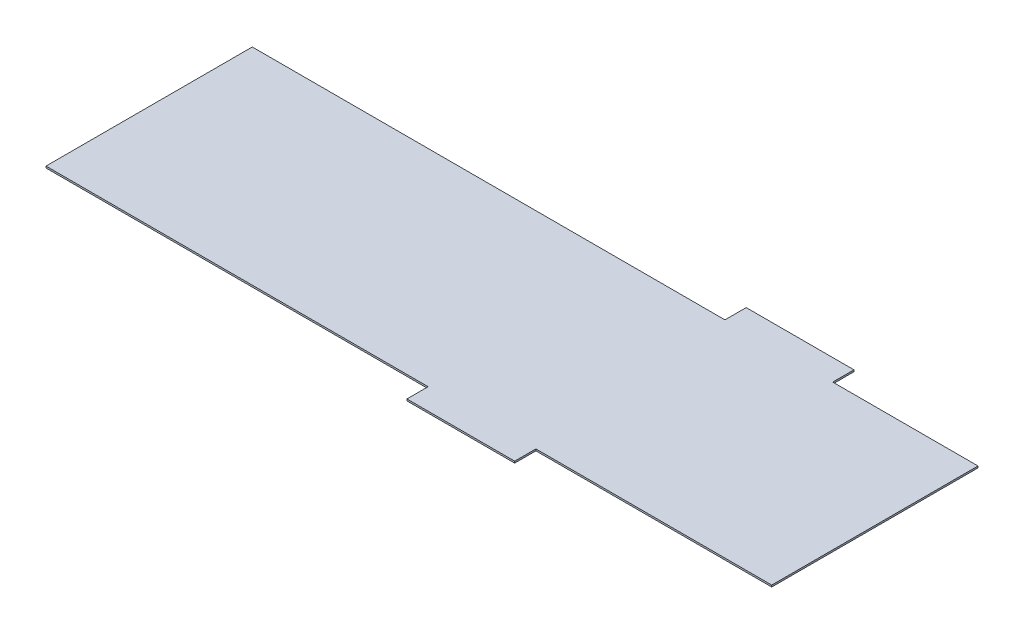
from build123d import *

# Parameters (mm, degrees)
SKETCH1_W                                    = 4208.52
SKETCH1_H                                    = 1196.206330057
BOTTOM_PLATE_DEPTH                           = 10
SKETCH4_W                                    = 624.951
SKETCH4_H                                    = 128.202330056
SKETCH4_H_2                                  = 128
PLATE_EXTENSION_FOR_ELEVATOR_MECHANISM_DEPTH = 10


with BuildPart() as part:
    # Sketch1 → Bottom plate (new body)
    with BuildSketch(Plane.XZ.offset(-287.23522809)):
        with Locations((-436.16279664, 1845.051757401)):
            Rectangle(SKETCH1_W, SKETCH1_H)
    extrude(amount=BOTTOM_PLATE_DEPTH)

    # Sketch4 → Plate extension for elevator mechanism (add)
    with BuildSketch(Plane.XZ.offset(-277.23522809)):
        with Locations((513.05270336, 1187.847427344)):
            Rectangle(SKETCH4_W, SKETCH4_H)
        with Locations((-11.89829664, 2502.154922429)):
            Rectangle(SKETCH4_W, SKETCH4_H_2)
    extrude(amount=-PLATE_EXTENSION_FOR_ELEVATOR_MECHANISM_DEPTH)


solid = part.part
